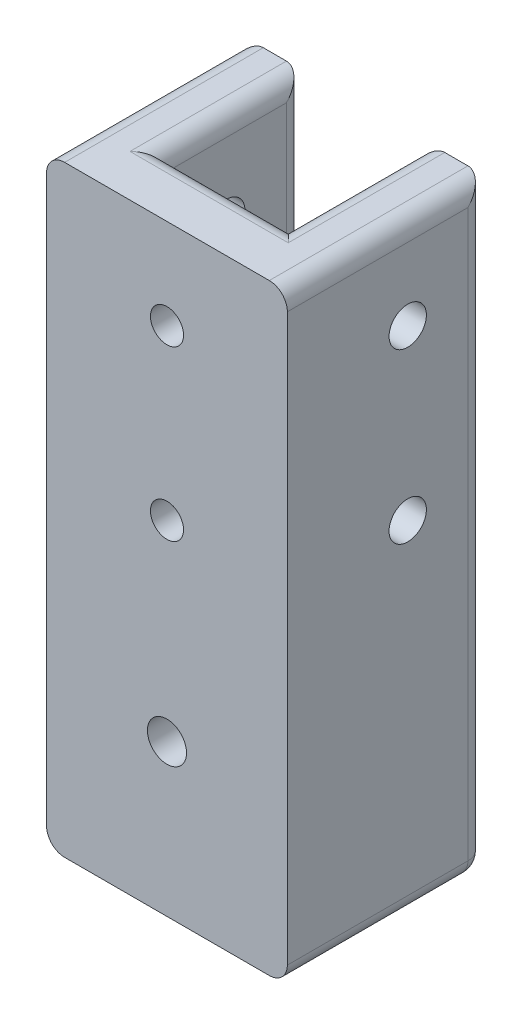
from build123d import *

# Parameters (mm, degrees)
SKETCH1_W               = 40
SKETCH1_H               = 100
BOSS_EXTRUDE1_DEPTH     = 25
BOSS_EXTRUDE2_START     = 25
SKETCH1_3_W             = 40
SKETCH1_3_H             = 100
SKETCH1_3_R             = 2.75
BOSS_EXTRUDE2_DEPTH     = 8
CUT_EXTRUDE1_START      = -50
SKETCH2_W               = 20.3
SKETCH2_H               = 23
CUT_EXTRUDE1_DEPTH      = 63.645461515
CUT_EXTRUDE2_DEPTH      = 110.535485118
CUT_EXTRUDE2_DEPTH_BACK = 110.535485118
SKETCH3_R               = 3.1
SKETCH4_R               = 2.75
CUT_EXTRUDE3_DEPTH      = 111.131739294
FILLET1_R               = 3
FILLET2_R               = 1
SKETCH6_R               = 3.25
CUT_EXTRUDE4_DEPTH      = 111.56672196


with BuildPart() as part:
    # Sketch1 → Boss-Extrude1 (new body)
    with BuildSketch(Plane.XY):
        with Locations((20, 50)):
            Rectangle(SKETCH1_W, SKETCH1_H)
        with BuildLine():
            Line((22.975, 37.8), (22.975, 34.854219443))
            ThreePointArc((22.975, 34.854219443), (28.161456671, 31.184328877), (30.15, 25.15))
            ThreePointArc((30.15, 25.15), (13.965671123, 16.988543329), (17.025, 34.854219443))
            Line((17.025, 34.854219443), (17.025, 37.8))
            Line((17.025, 37.8), (22.975, 37.8))
        make_face(mode=Mode.SUBTRACT)
    extrude(amount=BOSS_EXTRUDE1_DEPTH)

    # Sketch1<3> → Boss-Extrude2 (add)
    with BuildSketch(Plane.XY.offset(BOSS_EXTRUDE2_START)):
        with Locations((20, 50)):
            Rectangle(SKETCH1_3_W, SKETCH1_3_H)
        with Locations((20, 25.15)):
            Circle(SKETCH1_3_R, mode=Mode.SUBTRACT)
    extrude(amount=BOSS_EXTRUDE2_DEPTH)

    # Sketch2 → Cut-Extrude1 (cut, through all)
    with BuildSketch(Plane.XZ.offset(CUT_EXTRUDE1_START)):
        with Locations((20, 11.5)):
            Rectangle(SKETCH2_W, SKETCH2_H)
    extrude(amount=-CUT_EXTRUDE1_DEPTH, mode=Mode.SUBTRACT)

    # Sketch3 → Cut-Extrude2 (cut, two sides: drawn at the far end of the back side and taken through both)
    with BuildSketch(Plane.ZY.offset(-30.15).offset(-CUT_EXTRUDE2_DEPTH_BACK)):
        with Locations((13, 57)):
            Circle(SKETCH3_R)
        with Locations((13, 85)):
            Circle(SKETCH3_R)
    extrude(amount=CUT_EXTRUDE2_DEPTH + CUT_EXTRUDE2_DEPTH_BACK, mode=Mode.SUBTRACT)

    # Sketch4 → Cut-Extrude3 (cut, through all)
    with BuildSketch(Plane(origin=(0, 0, 23), x_dir=(-1, 0, 0), z_dir=(0, 0, -1))):
        with Locations((-20, 57)):
            Circle(SKETCH4_R)
        with Locations((-20, 85)):
            Circle(SKETCH4_R)
    extrude(amount=-CUT_EXTRUDE3_DEPTH, mode=Mode.SUBTRACT)

    # Fillet1
    fillet1_edges = [part.edges().sort_by_distance(p)[0] for p in [
        (0, 50, 0),
        (40, 50, 0),
        (20, 0, 0),
        (0, 0, 16.5),
        (0, 100, 16.5),
        (40, 100, 16.5),
        (40, 0, 16.5),
        (9.85, 100, 11.5),
        (9.85, 75, 0),
        (20, 100, 23),
        (30.15, 100, 11.5),
        (30.15, 75, 0),
        (20, 50, 0),
    ]]
    fillet(fillet1_edges, radius=FILLET1_R)

    # Fillet2
    fillet2_edges = [part.edges().sort_by_distance(p)[0] for p in [
        (22.975, 36.327109722, 0),
        (20, 37.8, 0),
        (17.025, 36.327109722, 0),
        (20, 15, 0),
    ]]
    fillet(fillet2_edges, radius=FILLET2_R)

    # Sketch6 → Cut-Extrude4 (cut, through all)
    with BuildSketch(Plane(origin=(0, 0, 25), x_dir=(-1, 0, 0), z_dir=(0, 0, -1))):
        with Locations((-20, 25.15)):
            Circle(SKETCH6_R)
    extrude(amount=-CUT_EXTRUDE4_DEPTH, mode=Mode.SUBTRACT)


solid = part.part
